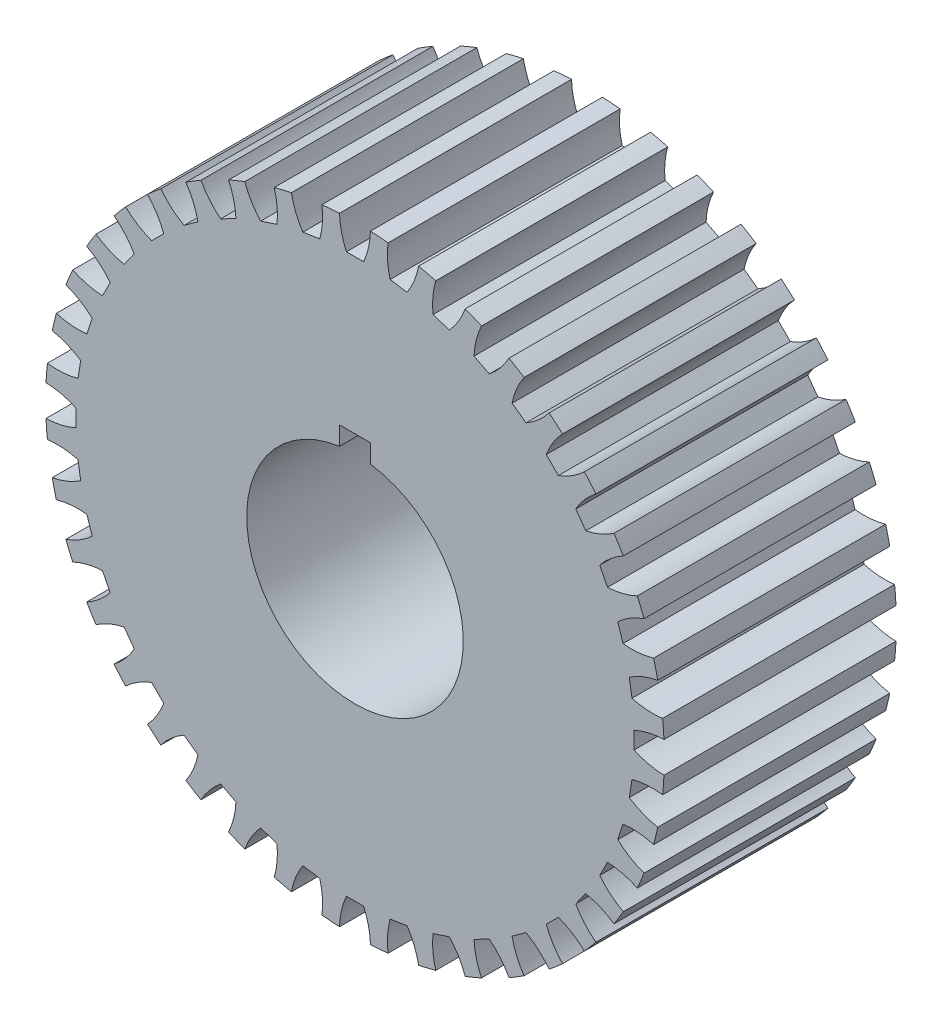
from build123d import *

# Parameters (mm, degrees)
SKETCH6_R                = 200
BOSS_EXTRUDE4_DEPTH      = 150
CUT_EXTRUDE6_DEPTH       = 150
SKETCH8_R                = 120
CUT_EXTRUDE7_DEPTH       = 42.5
CUT_EXTRUDE11_DEPTH      = 296.338788512
CUT_EXTRUDE11_DEPTH_BACK = 296.338788512


with BuildPart() as part:
    # Sketch6 → Boss-Extrude4 (new body)
    with BuildSketch(Plane.XY):
        Circle(SKETCH6_R)
    extrude(amount=BOSS_EXTRUDE4_DEPTH)

    # Sketch7 → Cut-Extrude6 (cut)
    with BuildSketch(Plane.XY):
        with BuildLine():
            Line((10, 81.282032303), (-10, 81.282032303))
            Line((-10, 81.282032303), (-10, 69.282032303))
            ThreePointArc((-10, 69.282032303), (0, -70), (10, 69.282032303))
            Line((10, 69.282032303), (10, 81.282032303))
        make_face()
    extrude(amount=CUT_EXTRUDE6_DEPTH, mode=Mode.SUBTRACT)

    # Sketch8 → Cut-Extrude7 (cut)
    with BuildSketch(Plane.XY):
        Circle(SKETCH8_R)
    extrude(amount=CUT_EXTRUDE7_DEPTH, mode=Mode.SUBTRACT)

    # Sketch9 → Cut-Extrude11 (cut, two sides: drawn at the far end of the back side and taken through both)
    with BuildSketch(Plane.XY.offset(65).offset(-CUT_EXTRUDE11_DEPTH_BACK)):
        with BuildLine():
            Line((-5.541889255, 180.41), (5.541889255, 180.41))
            ThreePointArc((5.541889255, 180.41), (8.746450762, 189.854931363), (9.996874512, 199.75))
            ThreePointArc((9.996874512, 199.75), (0, 210), (-9.996874512, 199.75))
            ThreePointArc((-9.996874512, 199.75), (-8.746450762, 189.854931363), (-5.541889255, 180.41))
        make_face()
        with BuildLine():
            Line((22.748682436, 179.055796008), (33.69600124, 177.321911046))
            ThreePointArc((33.69600124, 177.321911046), (38.338622062, 186.149255765), (41.121580789, 195.726890318))
            ThreePointArc((41.121580789, 195.726890318), (32.851237658, 207.414551525), (21.373987994, 198.85460175))
            ThreePointArc((21.373987994, 198.85460175), (21.061087184, 188.885748457), (22.748682436, 179.055796008))
        make_face()
        with BuildLine():
            Line((50.479106066, 173.292644066), (61.020405844, 169.867568144))
            ThreePointArc((61.020405844, 169.867568144), (66.986769249, 177.859967697), (71.233737273, 186.884335015))
            ThreePointArc((71.233737273, 186.884335015), (64.893568819, 199.721868422), (52.21855198, 193.062743245))
            ThreePointArc((52.21855198, 193.062743245), (50.350031265, 183.265571549), (50.479106066, 173.292644066))
        make_face()
        with BuildLine():
            Line((76.966566575, 163.262452101), (86.842285541, 158.230521956))
            ThreePointArc((86.842285541, 158.230521956), (93.98547986, 165.191176941), (99.591882734, 173.440067151))
            ThreePointArc((99.591882734, 173.440067151), (95.338004945, 187.11137008), (81.777321912, 182.517039262))
            ThreePointArc((81.777321912, 182.517039262), (78.399190475, 173.132788046), (76.966566575, 163.262452101))
        make_face()
        with BuildLine():
            Line((101.558854778, 149.212196729), (110.525819955, 142.697315181))
            ThreePointArc((110.525819955, 142.697315181), (118.669956037, 148.45483117), (125.497745516, 155.725129219))
            ThreePointArc((125.497745516, 155.725129219), (123.434902981, 169.893568819), (109.322462775, 167.477160033))
            ThreePointArc((109.322462775, 167.477160033), (104.517901423, 158.736900706), (101.558854778, 149.212196729))
        make_face()
        with BuildLine():
            Line((123.650426921, 131.487841867), (131.487841867, 123.650426921))
            ThreePointArc((131.487841867, 123.650426921), (140.432384053, 128.063034763), (148.3134373, 134.175721784))
            ThreePointArc((148.3134373, 134.175721784), (148.492424049, 148.492424049), (134.175721784, 148.3134373))
            ThreePointArc((134.175721784, 148.3134373), (128.063034763, 140.432384053), (123.650426921, 131.487841867))
        make_face()
        with BuildLine():
            Line((142.697315181, 110.525819955), (149.212196729, 101.558854778))
            ThreePointArc((149.212196729, 101.558854778), (158.736900706, 104.517901423), (167.477160033, 109.322462775))
            ThreePointArc((167.477160033, 109.322462775), (169.893568819, 123.434902981), (155.725129219, 125.497745516))
            ThreePointArc((155.725129219, 125.497745516), (148.45483117, 118.669956037), (142.697315181, 110.525819955))
        make_face()
        with BuildLine():
            Line((158.230521956, 86.842285541), (163.262452101, 76.966566575))
            ThreePointArc((163.262452101, 76.966566575), (173.132788046, 78.399190475), (182.517039262, 81.777321912))
            ThreePointArc((182.517039262, 81.777321912), (187.11137008, 95.338004945), (173.440067151, 99.591882734))
            ThreePointArc((173.440067151, 99.591882734), (165.191176941, 93.98547986), (158.230521956, 86.842285541))
        make_face()
        with BuildLine():
            Line((169.867568144, 61.020405844), (173.292644066, 50.479106066))
            ThreePointArc((173.292644066, 50.479106066), (183.265571549, 50.350031265), (193.062743245, 52.21855198))
            ThreePointArc((193.062743245, 52.21855198), (199.721868422, 64.893568819), (186.884335015, 71.233737273))
            ThreePointArc((186.884335015, 71.233737273), (177.859967697, 66.986769249), (169.867568144, 61.020405844))
        make_face()
        with BuildLine():
            Line((177.321911046, 33.69600124), (179.055796008, 22.748682436))
            ThreePointArc((179.055796008, 22.748682436), (188.885748457, 21.061087184), (198.85460175, 21.373987994))
            ThreePointArc((198.85460175, 21.373987994), (207.414551525, 32.851237658), (195.726890318, 41.121580789))
            ThreePointArc((195.726890318, 41.121580789), (186.149255765, 38.338622062), (177.321911046, 33.69600124))
        make_face()
        with BuildLine():
            Line((180.41, 5.541889255), (180.41, -5.541889255))
            ThreePointArc((180.41, -5.541889255), (189.854931363, -8.746450762), (199.75, -9.996874512))
            ThreePointArc((199.75, -9.996874512), (210, 0), (199.75, 9.996874512))
            ThreePointArc((199.75, 9.996874512), (189.854931363, 8.746450762), (180.41, 5.541889255))
        make_face()
        with BuildLine():
            Line((179.055796008, -22.748682436), (177.321911046, -33.69600124))
            ThreePointArc((177.321911046, -33.69600124), (186.149255765, -38.338622062), (195.726890318, -41.121580789))
            ThreePointArc((195.726890318, -41.121580789), (207.414551525, -32.851237658), (198.85460175, -21.373987994))
            ThreePointArc((198.85460175, -21.373987994), (188.885748457, -21.061087184), (179.055796008, -22.748682436))
        make_face()
        with BuildLine():
            Line((173.292644066, -50.479106066), (169.867568144, -61.020405844))
            ThreePointArc((169.867568144, -61.020405844), (177.859967697, -66.986769249), (186.884335015, -71.233737273))
            ThreePointArc((186.884335015, -71.233737273), (199.721868422, -64.893568819), (193.062743245, -52.21855198))
            ThreePointArc((193.062743245, -52.21855198), (183.265571549, -50.350031265), (173.292644066, -50.479106066))
        make_face()
        with BuildLine():
            Line((163.262452101, -76.966566575), (158.230521956, -86.842285541))
            ThreePointArc((158.230521956, -86.842285541), (165.191176941, -93.98547986), (173.440067151, -99.591882734))
            ThreePointArc((173.440067151, -99.591882734), (187.11137008, -95.338004945), (182.517039262, -81.777321912))
            ThreePointArc((182.517039262, -81.777321912), (173.132788046, -78.399190475), (163.262452101, -76.966566575))
        make_face()
        with BuildLine():
            Line((149.212196729, -101.558854778), (142.697315181, -110.525819955))
            ThreePointArc((142.697315181, -110.525819955), (148.45483117, -118.669956037), (155.725129219, -125.497745516))
            ThreePointArc((155.725129219, -125.497745516), (169.893568819, -123.434902981), (167.477160033, -109.322462775))
            ThreePointArc((167.477160033, -109.322462775), (158.736900706, -104.517901423), (149.212196729, -101.558854778))
        make_face()
        with BuildLine():
            Line((131.487841867, -123.650426921), (123.650426921, -131.487841867))
            ThreePointArc((123.650426921, -131.487841867), (128.063034763, -140.432384053), (134.175721784, -148.3134373))
            ThreePointArc((134.175721784, -148.3134373), (148.492424049, -148.492424049), (148.3134373, -134.175721784))
            ThreePointArc((148.3134373, -134.175721784), (140.432384053, -128.063034763), (131.487841867, -123.650426921))
        make_face()
        with BuildLine():
            Line((110.525819955, -142.697315181), (101.558854778, -149.212196729))
            ThreePointArc((101.558854778, -149.212196729), (104.517901423, -158.736900706), (109.322462775, -167.477160033))
            ThreePointArc((109.322462775, -167.477160033), (123.434902981, -169.893568819), (125.497745516, -155.725129219))
            ThreePointArc((125.497745516, -155.725129219), (118.669956037, -148.45483117), (110.525819955, -142.697315181))
        make_face()
        with BuildLine():
            Line((86.842285541, -158.230521956), (76.966566575, -163.262452101))
            ThreePointArc((76.966566575, -163.262452101), (78.399190475, -173.132788046), (81.777321912, -182.517039262))
            ThreePointArc((81.777321912, -182.517039262), (95.338004945, -187.11137008), (99.591882734, -173.440067151))
            ThreePointArc((99.591882734, -173.440067151), (93.98547986, -165.191176941), (86.842285541, -158.230521956))
        make_face()
        with BuildLine():
            Line((61.020405844, -169.867568144), (50.479106066, -173.292644066))
            ThreePointArc((50.479106066, -173.292644066), (50.350031265, -183.265571549), (52.21855198, -193.062743245))
            ThreePointArc((52.21855198, -193.062743245), (64.893568819, -199.721868422), (71.233737273, -186.884335015))
            ThreePointArc((71.233737273, -186.884335015), (66.986769249, -177.859967697), (61.020405844, -169.867568144))
        make_face()
        with BuildLine():
            Line((33.69600124, -177.321911046), (22.748682436, -179.055796008))
            ThreePointArc((22.748682436, -179.055796008), (21.061087184, -188.885748457), (21.373987994, -198.85460175))
            ThreePointArc((21.373987994, -198.85460175), (32.851237658, -207.414551525), (41.121580789, -195.726890318))
            ThreePointArc((41.121580789, -195.726890318), (38.338622062, -186.149255765), (33.69600124, -177.321911046))
        make_face()
        with BuildLine():
            Line((5.541889255, -180.41), (-5.541889255, -180.41))
            ThreePointArc((-5.541889255, -180.41), (-8.746450762, -189.854931363), (-9.996874512, -199.75))
            ThreePointArc((-9.996874512, -199.75), (0, -210), (9.996874512, -199.75))
            ThreePointArc((9.996874512, -199.75), (8.746450762, -189.854931363), (5.541889255, -180.41))
        make_face()
        with BuildLine():
            Line((-22.748682436, -179.055796008), (-33.69600124, -177.321911046))
            ThreePointArc((-33.69600124, -177.321911046), (-38.338622062, -186.149255765), (-41.121580789, -195.726890318))
            ThreePointArc((-41.121580789, -195.726890318), (-32.851237658, -207.414551525), (-21.373987994, -198.85460175))
            ThreePointArc((-21.373987994, -198.85460175), (-21.061087184, -188.885748457), (-22.748682436, -179.055796008))
        make_face()
        with BuildLine():
            Line((-50.479106066, -173.292644066), (-61.020405844, -169.867568144))
            ThreePointArc((-61.020405844, -169.867568144), (-66.986769249, -177.859967697), (-71.233737273, -186.884335015))
            ThreePointArc((-71.233737273, -186.884335015), (-64.893568819, -199.721868422), (-52.21855198, -193.062743245))
            ThreePointArc((-52.21855198, -193.062743245), (-50.350031265, -183.265571549), (-50.479106066, -173.292644066))
        make_face()
        with BuildLine():
            Line((-76.966566575, -163.262452101), (-86.842285541, -158.230521956))
            ThreePointArc((-86.842285541, -158.230521956), (-93.98547986, -165.191176941), (-99.591882734, -173.440067151))
            ThreePointArc((-99.591882734, -173.440067151), (-95.338004945, -187.11137008), (-81.777321912, -182.517039262))
            ThreePointArc((-81.777321912, -182.517039262), (-78.399190475, -173.132788046), (-76.966566575, -163.262452101))
        make_face()
        with BuildLine():
            Line((-101.558854778, -149.212196729), (-110.525819955, -142.697315181))
            ThreePointArc((-110.525819955, -142.697315181), (-118.669956037, -148.45483117), (-125.497745516, -155.725129219))
            ThreePointArc((-125.497745516, -155.725129219), (-123.434902981, -169.893568819), (-109.322462775, -167.477160033))
            ThreePointArc((-109.322462775, -167.477160033), (-104.517901423, -158.736900706), (-101.558854778, -149.212196729))
        make_face()
        with BuildLine():
            Line((-123.650426921, -131.487841867), (-131.487841867, -123.650426921))
            ThreePointArc((-131.487841867, -123.650426921), (-140.432384053, -128.063034763), (-148.3134373, -134.175721784))
            ThreePointArc((-148.3134373, -134.175721784), (-148.492424049, -148.492424049), (-134.175721784, -148.3134373))
            ThreePointArc((-134.175721784, -148.3134373), (-128.063034763, -140.432384053), (-123.650426921, -131.487841867))
        make_face()
        with BuildLine():
            Line((-142.697315181, -110.525819955), (-149.212196729, -101.558854778))
            ThreePointArc((-149.212196729, -101.558854778), (-158.736900706, -104.517901423), (-167.477160033, -109.322462775))
            ThreePointArc((-167.477160033, -109.322462775), (-169.893568819, -123.434902981), (-155.725129219, -125.497745516))
            ThreePointArc((-155.725129219, -125.497745516), (-148.45483117, -118.669956037), (-142.697315181, -110.525819955))
        make_face()
        with BuildLine():
            Line((-158.230521956, -86.842285541), (-163.262452101, -76.966566575))
            ThreePointArc((-163.262452101, -76.966566575), (-173.132788046, -78.399190475), (-182.517039262, -81.777321912))
            ThreePointArc((-182.517039262, -81.777321912), (-187.11137008, -95.338004945), (-173.440067151, -99.591882734))
            ThreePointArc((-173.440067151, -99.591882734), (-165.191176941, -93.98547986), (-158.230521956, -86.842285541))
        make_face()
        with BuildLine():
            Line((-169.867568144, -61.020405844), (-173.292644066, -50.479106066))
            ThreePointArc((-173.292644066, -50.479106066), (-183.265571549, -50.350031265), (-193.062743245, -52.21855198))
            ThreePointArc((-193.062743245, -52.21855198), (-199.721868422, -64.893568819), (-186.884335015, -71.233737273))
            ThreePointArc((-186.884335015, -71.233737273), (-177.859967697, -66.986769249), (-169.867568144, -61.020405844))
        make_face()
        with BuildLine():
            Line((-177.321911046, -33.69600124), (-179.055796008, -22.748682436))
            ThreePointArc((-179.055796008, -22.748682436), (-188.885748457, -21.061087184), (-198.85460175, -21.373987994))
            ThreePointArc((-198.85460175, -21.373987994), (-207.414551525, -32.851237658), (-195.726890318, -41.121580789))
            ThreePointArc((-195.726890318, -41.121580789), (-186.149255765, -38.338622062), (-177.321911046, -33.69600124))
        make_face()
        with BuildLine():
            Line((-180.41, -5.541889255), (-180.41, 5.541889255))
            ThreePointArc((-180.41, 5.541889255), (-189.854931362, 8.746450762), (-199.75, 9.996874512))
            ThreePointArc((-199.75, 9.996874512), (-210, 0), (-199.75, -9.996874512))
            ThreePointArc((-199.75, -9.996874512), (-189.854931362, -8.746450762), (-180.41, -5.541889255))
        make_face()
        with BuildLine():
            Line((-179.055796008, 22.748682436), (-177.321911046, 33.69600124))
            ThreePointArc((-177.321911046, 33.69600124), (-186.149255765, 38.338622062), (-195.726890318, 41.121580789))
            ThreePointArc((-195.726890318, 41.121580789), (-207.414551525, 32.851237658), (-198.85460175, 21.373987994))
            ThreePointArc((-198.85460175, 21.373987994), (-188.885748457, 21.061087184), (-179.055796008, 22.748682436))
        make_face()
        with BuildLine():
            Line((-173.292644066, 50.479106066), (-169.867568144, 61.020405844))
            ThreePointArc((-169.867568144, 61.020405844), (-177.859967697, 66.986769249), (-186.884335015, 71.233737273))
            ThreePointArc((-186.884335015, 71.233737273), (-199.721868422, 64.893568819), (-193.062743245, 52.21855198))
            ThreePointArc((-193.062743245, 52.21855198), (-183.265571549, 50.350031265), (-173.292644066, 50.479106066))
        make_face()
        with BuildLine():
            Line((-163.262452101, 76.966566575), (-158.230521956, 86.842285541))
            ThreePointArc((-158.230521956, 86.842285541), (-165.191176941, 93.98547986), (-173.440067151, 99.591882734))
            ThreePointArc((-173.440067151, 99.591882734), (-187.11137008, 95.338004945), (-182.517039262, 81.777321912))
            ThreePointArc((-182.517039262, 81.777321912), (-173.132788046, 78.399190475), (-163.262452101, 76.966566575))
        make_face()
        with BuildLine():
            Line((-149.212196729, 101.558854778), (-142.697315181, 110.525819955))
            ThreePointArc((-142.697315181, 110.525819955), (-148.45483117, 118.669956037), (-155.725129219, 125.497745516))
            ThreePointArc((-155.725129219, 125.497745516), (-169.893568819, 123.434902981), (-167.477160033, 109.322462775))
            ThreePointArc((-167.477160033, 109.322462775), (-158.736900706, 104.517901423), (-149.212196729, 101.558854778))
        make_face()
        with BuildLine():
            Line((-131.487841867, 123.650426921), (-123.650426921, 131.487841867))
            ThreePointArc((-123.650426921, 131.487841867), (-128.063034763, 140.432384053), (-134.175721784, 148.3134373))
            ThreePointArc((-134.175721784, 148.3134373), (-148.492424049, 148.492424049), (-148.3134373, 134.175721784))
            ThreePointArc((-148.3134373, 134.175721784), (-140.432384053, 128.063034763), (-131.487841867, 123.650426921))
        make_face()
        with BuildLine():
            Line((-110.525819955, 142.697315181), (-101.558854778, 149.212196729))
            ThreePointArc((-101.558854778, 149.212196729), (-104.517901423, 158.736900706), (-109.322462775, 167.477160033))
            ThreePointArc((-109.322462775, 167.477160033), (-123.434902981, 169.893568819), (-125.497745516, 155.725129219))
            ThreePointArc((-125.497745516, 155.725129219), (-118.669956037, 148.45483117), (-110.525819955, 142.697315181))
        make_face()
        with BuildLine():
            Line((-86.842285541, 158.230521956), (-76.966566575, 163.262452101))
            ThreePointArc((-76.966566575, 163.262452101), (-78.399190475, 173.132788046), (-81.777321912, 182.517039262))
            ThreePointArc((-81.777321912, 182.517039262), (-95.338004945, 187.11137008), (-99.591882734, 173.440067151))
            ThreePointArc((-99.591882734, 173.440067151), (-93.98547986, 165.191176941), (-86.842285541, 158.230521956))
        make_face()
        with BuildLine():
            Line((-61.020405844, 169.867568144), (-50.479106066, 173.292644066))
            ThreePointArc((-50.479106066, 173.292644066), (-50.350031265, 183.265571549), (-52.21855198, 193.062743245))
            ThreePointArc((-52.21855198, 193.062743245), (-64.893568819, 199.721868422), (-71.233737273, 186.884335015))
            ThreePointArc((-71.233737273, 186.884335015), (-66.986769249, 177.859967697), (-61.020405844, 169.867568144))
        make_face()
        with BuildLine():
            Line((-33.69600124, 177.321911046), (-22.748682436, 179.055796008))
            ThreePointArc((-22.748682436, 179.055796008), (-21.061087184, 188.885748457), (-21.373987994, 198.85460175))
            ThreePointArc((-21.373987994, 198.85460175), (-32.851237658, 207.414551525), (-41.121580789, 195.726890318))
            ThreePointArc((-41.121580789, 195.726890318), (-38.338622062, 186.149255765), (-33.69600124, 177.321911046))
        make_face()
    extrude(amount=CUT_EXTRUDE11_DEPTH + CUT_EXTRUDE11_DEPTH_BACK, mode=Mode.SUBTRACT)


solid = part.part
